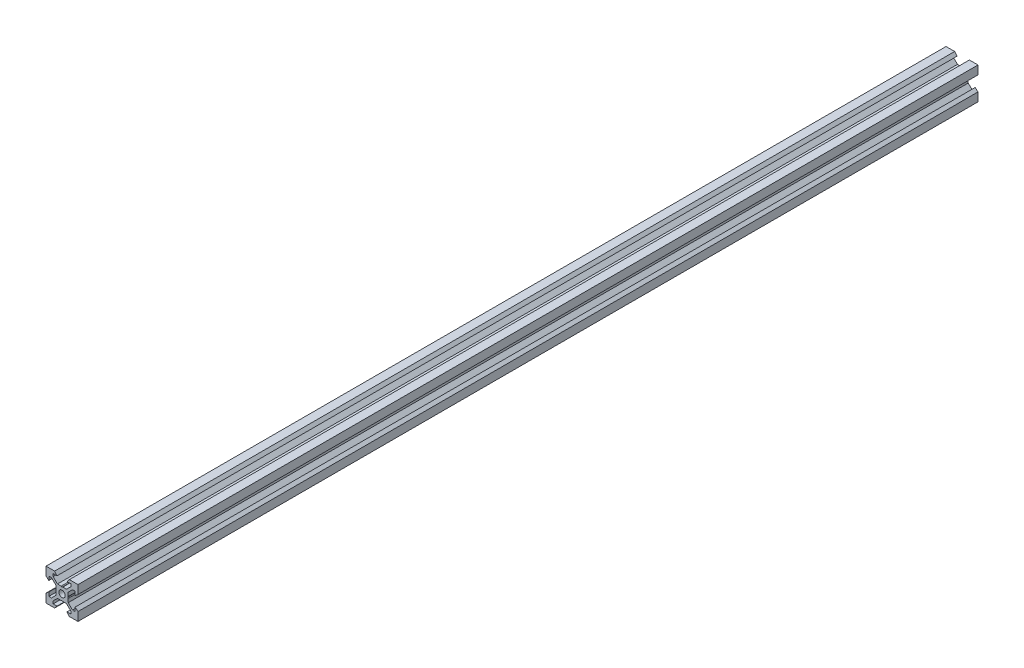
from build123d import *

# Parameters (mm, degrees)
SKETCH1_R           = 2
BOSS_EXTRUDE1_DEPTH = 281.5


with BuildPart() as part:
    # Sketch1 → Boss-Extrude1 (new, symmetric)
    with BuildSketch(Plane.XY):
        Polygon((10, 10), (10, 4.610379336), (8.2, 3.1), (8.2, 5.5), (6.560660172, 5.5), (3.9, 2.839339828), (3.9, 0.519615242), (3.6, 0), (3.9, -0.519615242), (3.9, -2.839339828), (6.560660172, -5.5), (8.2, -5.5), (8.2, -3.1), (10, -4.610379336), (10, -10), (4.610379336, -10), (3.1, -8.2), (5.5, -8.2), (5.5, -6.560660172), (2.839339828, -3.9), (0.519615242, -3.9), (0, -3.6), (-0.519615242, -3.9), (-2.839339828, -3.9), (-5.5, -6.560660172), (-5.5, -8.2), (-3.1, -8.2), (-4.610379336, -10), (-10, -10), (-10, -4.610379336), (-8.2, -3.1), (-8.2, -5.5), (-6.560660172, -5.5), (-3.9, -2.839339828), (-3.9, -0.519615242), (-3.6, 0), (-3.9, 0.519615242), (-3.9, 2.839339828), (-6.560660172, 5.5), (-8.2, 5.5), (-8.2, 3.1), (-10, 4.610379336), (-10, 10), (-4.610379336, 10), (-3.1, 8.2), (-5.5, 8.2), (-5.5, 6.560660172), (-2.839339828, 3.9), (-0.519615242, 3.9), (0, 3.6), (0.519615242, 3.9), (2.839339828, 3.9), (5.5, 6.560660172), (5.5, 8.2), (3.1, 8.2), (4.610379336, 10), align=None)
        Circle(SKETCH1_R, mode=Mode.SUBTRACT)
    extrude(amount=BOSS_EXTRUDE1_DEPTH, both=True)


solid = part.part
